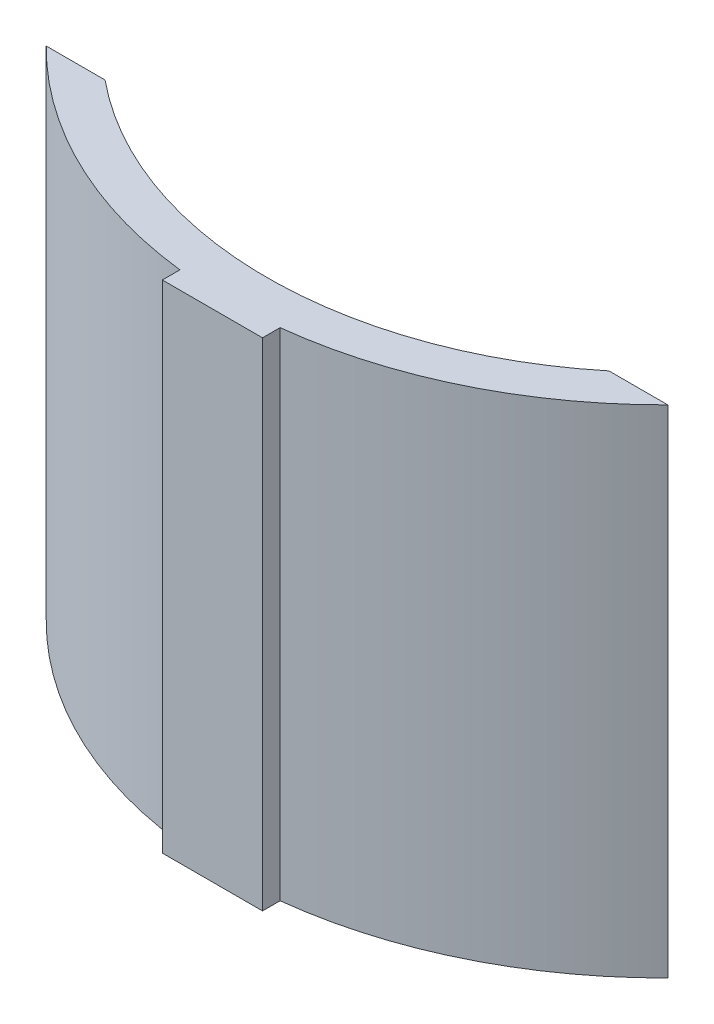
from build123d import *

# Parameters (mm, degrees)
BOSS_EXTRUDE1_DEPTH = 25


with BuildPart() as part:
    # Sketch1 → Boss-Extrude1 (new body)
    with BuildSketch(Plane(origin=(0, 0, 0), x_dir=(1, 0, 0), z_dir=(0, 1, 0))):
        with BuildLine():
            Line((-15.653135277, -15.458957145), (-12.689391002, -15.458957145))
            ThreePointArc((-12.689391002, -15.458957145), (0, -20), (12.689391002, -15.458957145))
            Line((12.689391002, -15.458957145), (15.653135277, -15.458957145))
            ThreePointArc((15.653135277, -15.458957145), (9.634106681, -19.778371734), (2.522561476, -21.854900677))
            Line((2.522561476, -21.854900677), (2.522561476, -22.740089193))
            Line((2.522561476, -22.740089193), (-2.522561476, -22.740089193))
            Line((-2.522561476, -22.740089193), (-2.522561476, -21.854900677))
            ThreePointArc((-2.522561476, -21.854900677), (-9.634106681, -19.778371734), (-15.653135277, -15.458957145))
        make_face()
    extrude(amount=BOSS_EXTRUDE1_DEPTH)


solid = part.part
